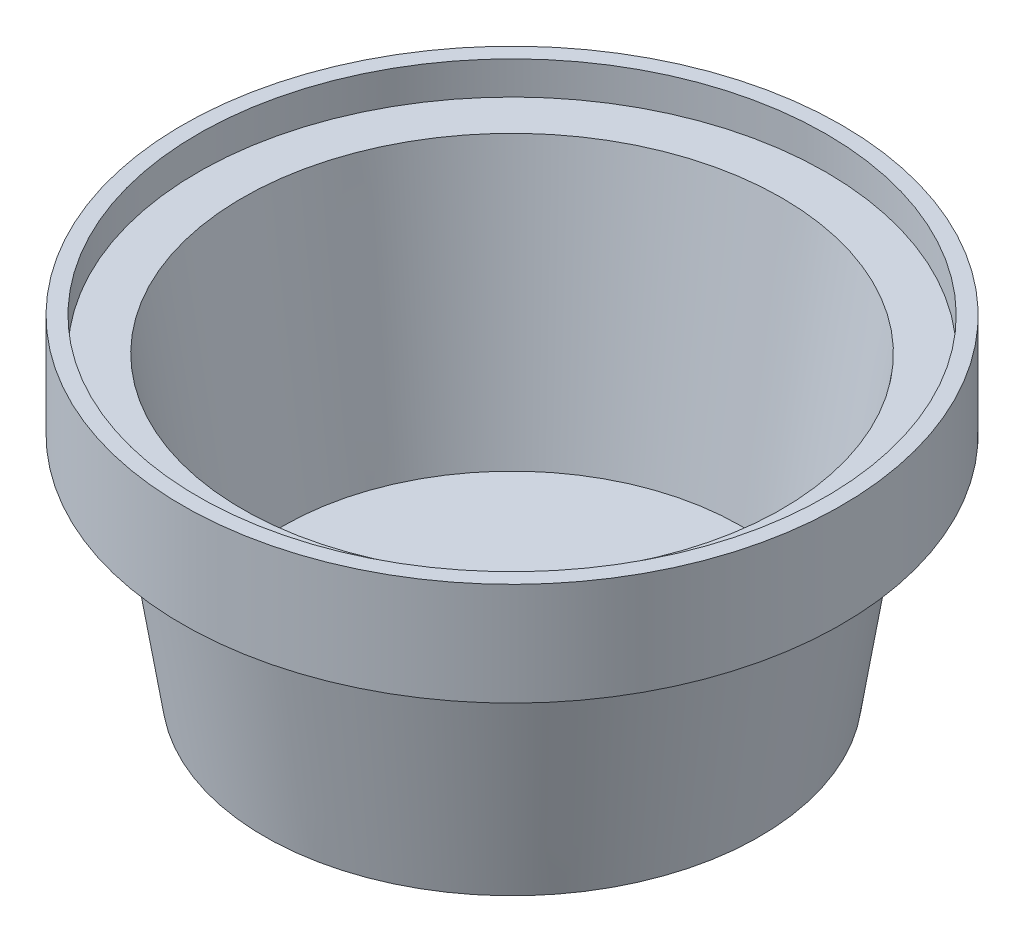
from build123d import *

# Parameters (mm, degrees)
SKETCH2_R          = 8.001
SKETCH2_R_2        = 2.2225
CUT_EXTRUDE1_DEPTH = 91.48908463


with BuildPart() as part:
    # Sketch1 → Revolve1 (revolve)
    with BuildSketch(Plane.XY, mode=Mode.PRIVATE) as revolve1_sk:
        Polygon((37.465, 4.32701069), (44.163455703, 47.50701069), (51.435, 47.50701069), (51.435, 52.924059852), (53.975, 52.924059852), (53.975, 46.574059852), (53.975, 36.07701069), (51.435, 36.07701069), (51.435, 44.96701069), (47.625, 44.96701069), (40.532517491, -0.75298931), (0, -0.75298931), (0, 4.32701069), align=None)
    revolve(revolve1_sk.sketch.rotate(Axis((0, 0, 0), (0, 1, 0)), 90), axis=Axis((0, 0, 0), (0, 1, 0)))

    # Sketch2 → Cut-Extrude1 (cut, through all)
    with BuildSketch(Plane(origin=(0, 4.32701069, 0), x_dir=(1, 0, 0), z_dir=(0, 1, 0))):
        with Locations(Location((-12.89685, 0, 0), (0, 0, 270))):
            Circle(SKETCH2_R)
        with Locations(Location((12.89685, 0, 0), (0, 0, 270))):
            Circle(SKETCH2_R)
        with Locations(Location((0, -29.968876042, 0), (0, 0, 270))):
            Circle(SKETCH2_R_2)
    extrude(amount=-CUT_EXTRUDE1_DEPTH, mode=Mode.SUBTRACT)


solid = part.part
